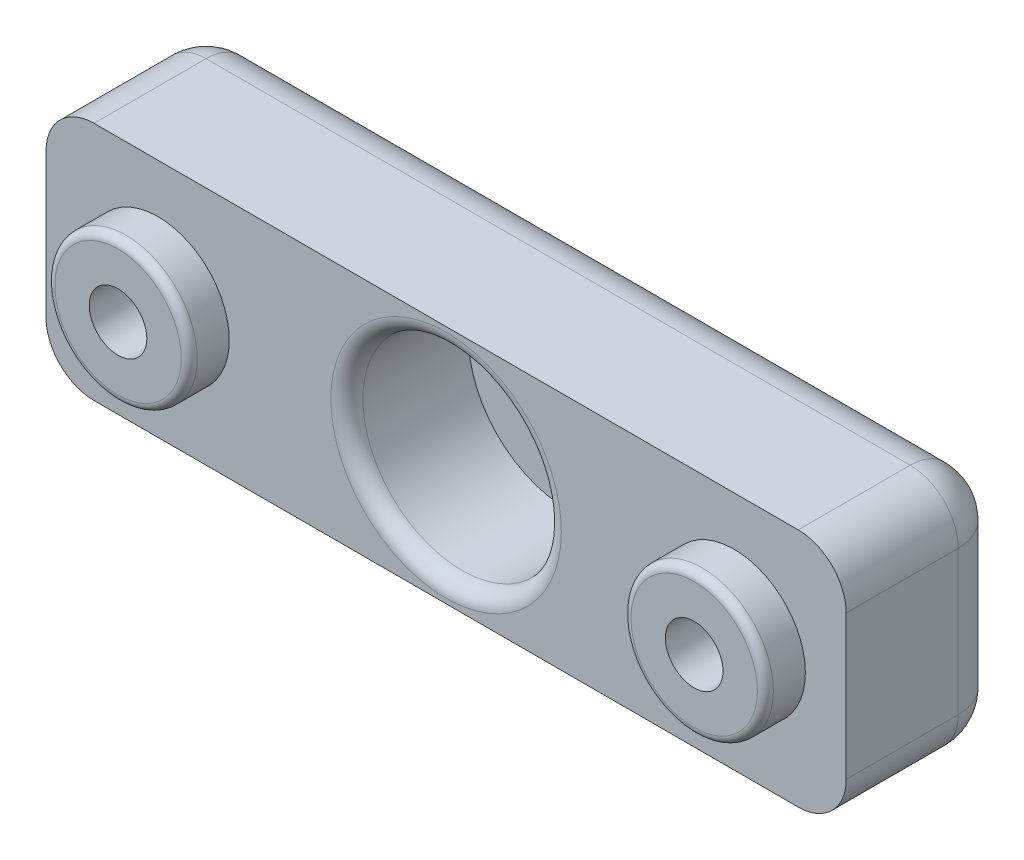
from build123d import *

# Parameters (mm, degrees)
CROQUIS1_W              = 50
CROQUIS1_H              = 15
SALIENTE_EXTRUIR1_DEPTH = 10
CROQUIS2_R              = 6.2
CROQUIS2_R_2            = 4.45
SALIENTE_EXTRUIR2_DEPTH = 2.5
CORTAR_EXTRUIR1_START   = -10.1
CROQUIS3_R              = 6.2
CORTAR_EXTRUIR1_DEPTH   = 10.1
CROQUIS4_R              = 1.8
CORTAR_EXTRUIR2_DEPTH   = 15.5
CORTAR_EXTRUIR3_DEPTH   = 3.5
REDONDEO1_R             = 3
REDONDEO2_R             = 1
REDONDEO3_R             = 0.5


with BuildPart() as part:
    # Croquis1 → Saliente-Extruir1 (new body)
    with BuildSketch(Plane.XY):
        with Locations((-2.430013275, 8.597922849)):
            Rectangle(CROQUIS1_W, CROQUIS1_H)
    extrude(amount=SALIENTE_EXTRUIR1_DEPTH)

    # Croquis2 → Saliente-Extruir2 (add)
    with BuildSketch(Plane.XY.offset(10)):
        with Locations((-2.430013275, 8.597922849)):
            Circle(CROQUIS2_R)
        with Locations((-20.430013275, 8.597922849)):
            Circle(CROQUIS2_R_2)
        with Locations((15.569986725, 8.597922849)):
            Circle(CROQUIS2_R_2)
    extrude(amount=SALIENTE_EXTRUIR2_DEPTH)

    # Croquis3 → Cortar-Extruir1 (cut)
    with BuildSketch(Plane.XY.offset(12.5).offset(CORTAR_EXTRUIR1_START)):
        with Locations((-2.430013275, 8.597922849)):
            Circle(CROQUIS3_R)
    extrude(amount=CORTAR_EXTRUIR1_DEPTH, mode=Mode.SUBTRACT)

    # Croquis4 → Cortar-Extruir2 (cut)
    with BuildSketch(Plane.XY.offset(12.5)):
        with Locations((-20.430013275, 8.597922849)):
            Circle(CROQUIS4_R)
        with Locations((15.569986725, 8.597922849)):
            Circle(CROQUIS4_R)
    extrude(amount=-CORTAR_EXTRUIR2_DEPTH, mode=Mode.SUBTRACT)

    # Croquis5 → Cortar-Extruir3 (cut)
    with BuildSketch(Plane(origin=(0, 0, 0), x_dir=(-1, 0, 0), z_dir=(0, 0, -1))):
        Polygon((-12.048150083, 8.597922849), (-13.809068404, 11.647922849), (-17.330905046, 11.647922849), (-19.091823367, 8.597922849), (-17.330905046, 5.547922849), (-13.809068404, 5.547922849), align=None)
        Polygon((23.951849917, 8.597922849), (22.190931596, 11.647922849), (18.669094954, 11.647922849), (16.908176633, 8.597922849), (18.669094954, 5.547922849), (22.190931596, 5.547922849), align=None)
    extrude(amount=-CORTAR_EXTRUIR3_DEPTH, mode=Mode.SUBTRACT)

    # Redondeo1
    redondeo1_edges = [part.edges().sort_by_distance(p)[0] for p in [
        (-2.430013275, 16.097922849, 0),
        (22.569986725, 8.597922849, 0),
        (-2.430013275, 1.097922849, 0),
        (-27.430013275, 8.597922849, 0),
        (-27.430013275, 16.097922849, 5),
        (22.569986725, 16.097922849, 5),
        (22.569986725, 1.097922849, 5),
        (-27.430013275, 1.097922849, 5),
    ]]
    fillet(redondeo1_edges, radius=REDONDEO1_R)

    # Redondeo2
    redondeo2_edges = [part.edges().sort_by_distance(p)[0] for p in [
        (-8.630013275, 8.597922849, 10),
    ]]
    fillet(redondeo2_edges, radius=REDONDEO2_R)

    # Redondeo3
    redondeo3_edges = [part.edges().sort_by_distance(p)[0] for p in [
        (-24.880013275, 8.597922849, 12.5),
        (11.119986725, 8.597922849, 12.5),
    ]]
    fillet(redondeo3_edges, radius=REDONDEO3_R)


solid = part.part
